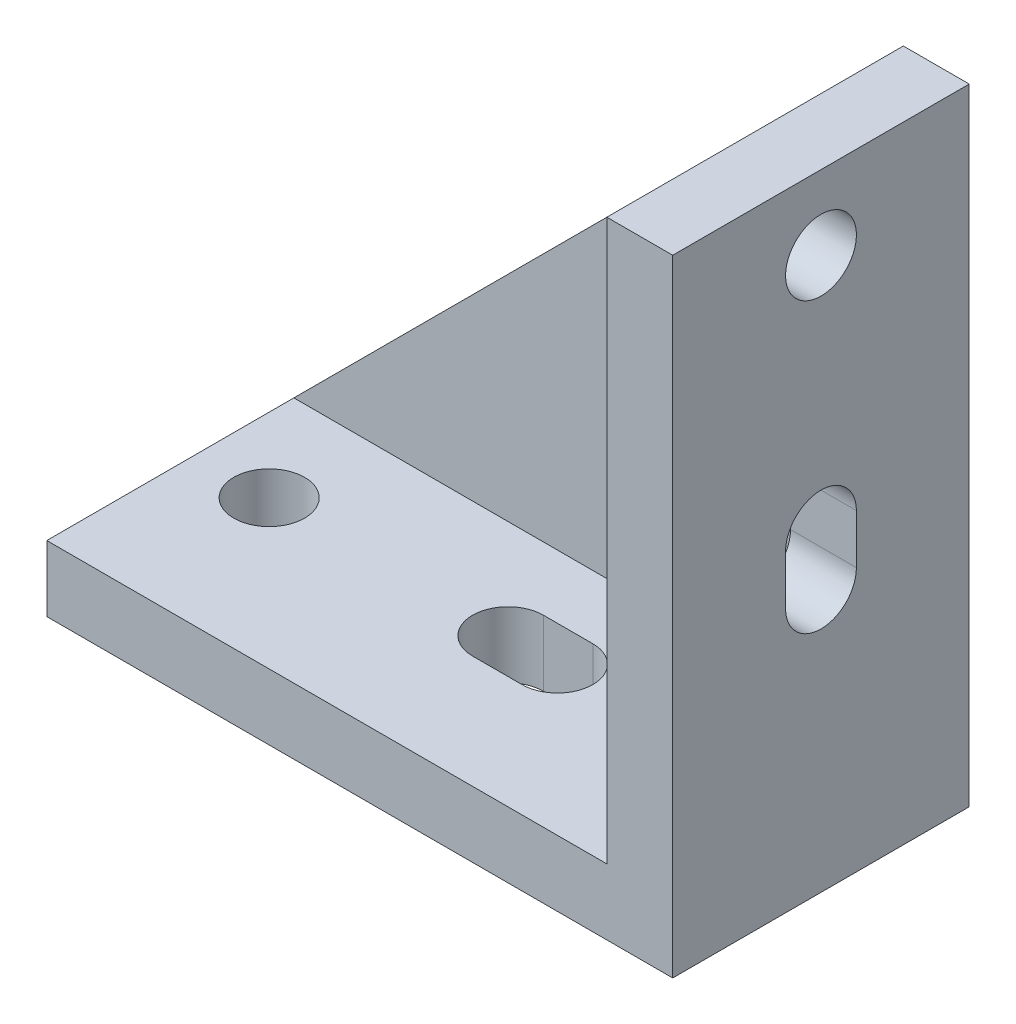
from build123d import *

# Parameters (mm, degrees)
EXTRUDE_1_DEPTH     = 9
EXTRUDE_2_DEPTH     = 3
SKETCH_4_R          = 2.15
CUT_EXTRUDE_1_DEPTH = 52.778373864


with BuildPart() as part:
    # 草图1 → 凸台-拉伸1 (new, symmetric)
    with BuildSketch(Plane.XY):
        Polygon((-38, 0), (0, 0), (0, 38), (-4, 38), (-4, 4), (-38, 4), align=None)
    extrude(amount=EXTRUDE_1_DEPTH, both=True)

    # 草图3 → 凸台-拉伸2 (add)
    with BuildSketch(Plane(origin=(0, 0, -9), x_dir=(-1, 0, 0), z_dir=(0, 0, -1))):
        Polygon((38, 4), (4, 38), (4, 4), align=None)
    extrude(amount=-EXTRUDE_2_DEPTH)

    # 草图4 → 切除-拉伸1 (cut, through all)
    with BuildSketch(Plane(origin=(0, 4, 0), x_dir=(1, 0, 0), z_dir=(0, 1, 0))):
        with Locations(Location((-33.5, 0, 0), (0, 0, 270))):
            Circle(SKETCH_4_R)
        with BuildLine():
            Line((-16, -2.15), (-19, -2.15))
            ThreePointArc((-19, -2.15), (-21.15, 0), (-19, 2.15))
            Line((-19, 2.15), (-16, 2.15))
            ThreePointArc((-16, 2.15), (-13.85, 0), (-16, -2.15))
        make_face()
    cut_extrude_1 = extrude(amount=-CUT_EXTRUDE_1_DEPTH, mode=Mode.SUBTRACT)

    # 镜向1: 切除-拉伸1 across plane
    add(cut_extrude_1.mirror(Plane(origin=(0, 0, 0), x_dir=(0, 0, 1), z_dir=(-0.7071067811865477, -0.7071067811865475, 0))), mode=Mode.SUBTRACT)


solid = part.part
